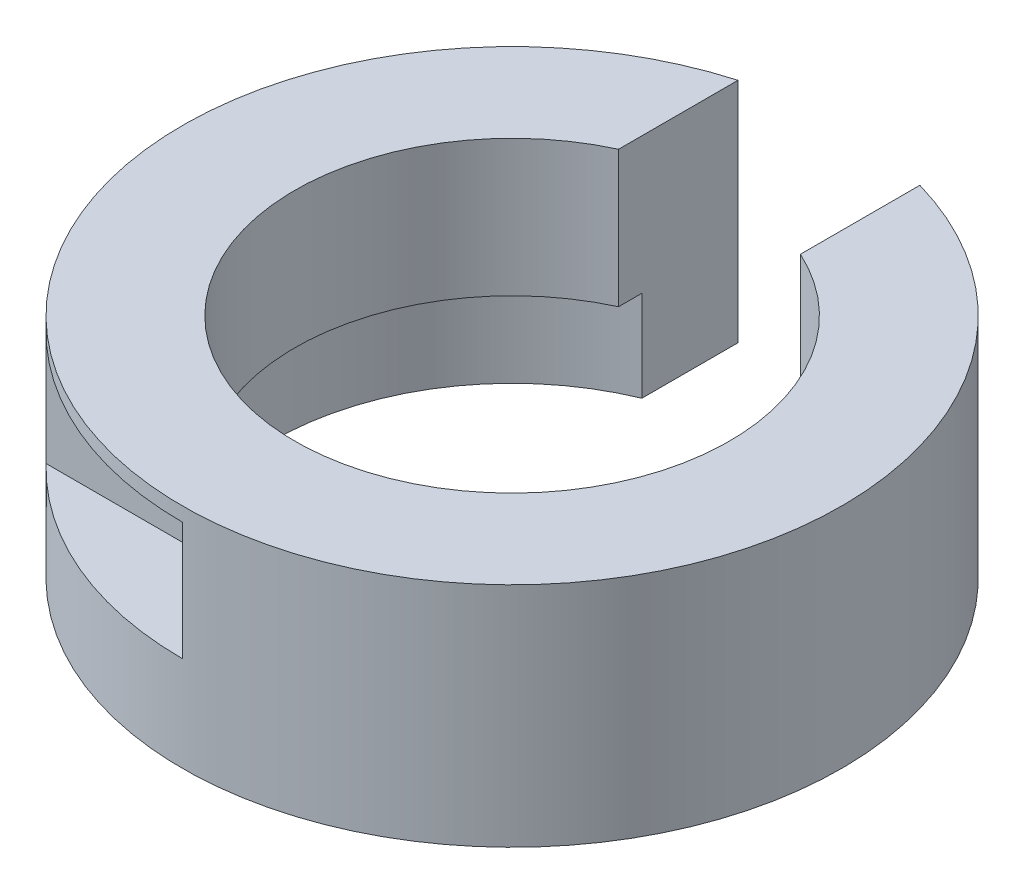
from build123d import *

# Parameters (mm, degrees)
ESBO_O1_R                  = 72.5
ESBO_O1_R_2                = 52.5
RESSALTO_EXTRUS_O1_DEPTH   = 50
CORTE_EXTRUS_O1_DEPTH      = 115.072345465
CORTE_EXTRUS_O1_DEPTH_BACK = 115.072345465
ESBO_O2_W                  = 40
ESBO_O2_H                  = 97.356983932
RESSALTO_EXTRUS_O2_START   = -30
ESBO_O3_R                  = 52.5
ESBO_O3_R_2                = 47.8
RESSALTO_EXTRUS_O2_DEPTH   = 30
CORTE_EXTRUS_O2_DEPTH      = 115.072345465
CORTE_EXTRUS_O2_DEPTH_BACK = 115.072345465
ESBO_O5_W                  = 23.143765799
ESBO_O5_H                  = 26
CORTE_EXTRUS_O3_DEPTH      = 115.072345465


with BuildPart() as part:
    # Esboço1 → Ressalto-extrusão1 (new body)
    with BuildSketch(Plane(origin=(0, 0, 0), x_dir=(1, 0, 0), z_dir=(0, 1, 0))):
        with Locations(Location((0, 0, 0), (0, 0, 270))):
            Circle(ESBO_O1_R)
        with Locations(Location((0, 0, 0), (0, 0, 270))):
            Circle(ESBO_O1_R_2, mode=Mode.SUBTRACT)
    extrude(amount=RESSALTO_EXTRUS_O1_DEPTH)

    # Esboço2 → Corte-extrusão1 (cut, two sides: drawn at the far end of the back side and taken through both)
    with BuildSketch(Plane(origin=(0, 50, 0), x_dir=(1, 0, 0), z_dir=(0, 1, 0)).offset(-CORTE_EXTRUS_O1_DEPTH_BACK)):
        with Locations((0, 48.678491966)):
            Rectangle(ESBO_O2_W, ESBO_O2_H)
    extrude(amount=CORTE_EXTRUS_O1_DEPTH + CORTE_EXTRUS_O1_DEPTH_BACK, mode=Mode.SUBTRACT)

    # Esboço3 → Ressalto-extrusão2 (add)
    with BuildSketch(Plane(origin=(0, 50, 0), x_dir=(1, 0, 0), z_dir=(0, 1, 0)).offset(RESSALTO_EXTRUS_O2_START)):
        Circle(ESBO_O3_R)
        with Locations(Location((0, 0, 0), (0, 0, 270))):
            Circle(ESBO_O3_R_2, mode=Mode.SUBTRACT)
    extrude(amount=RESSALTO_EXTRUS_O2_DEPTH)

    # Esboço4 → Corte-extrusão2 (cut, two sides: drawn at the far end of the back side and taken through both)
    with BuildSketch(Plane(origin=(0, 50, 0), x_dir=(1, 0, 0), z_dir=(0, 1, 0)).offset(-CORTE_EXTRUS_O2_DEPTH_BACK)):
        Polygon((-20, 69.686799324), (-20, 29.755386526), (20, 29.755386526), (20, 73.66525197), (-20, 73.66525197), align=None)
    extrude(amount=CORTE_EXTRUS_O2_DEPTH + CORTE_EXTRUS_O2_DEPTH_BACK, mode=Mode.SUBTRACT)

    # Esboço5 → Corte-extrusão3 (cut, through all)
    with BuildSketch(Plane(origin=(0, 0, 0), x_dir=(0, 0, -1), z_dir=(1, 0, 0))):
        with Locations((-61.895664133, 33.904990218)):
            Rectangle(ESBO_O5_W, ESBO_O5_H)
    extrude(amount=-CORTE_EXTRUS_O3_DEPTH, mode=Mode.SUBTRACT)


solid = part.part
